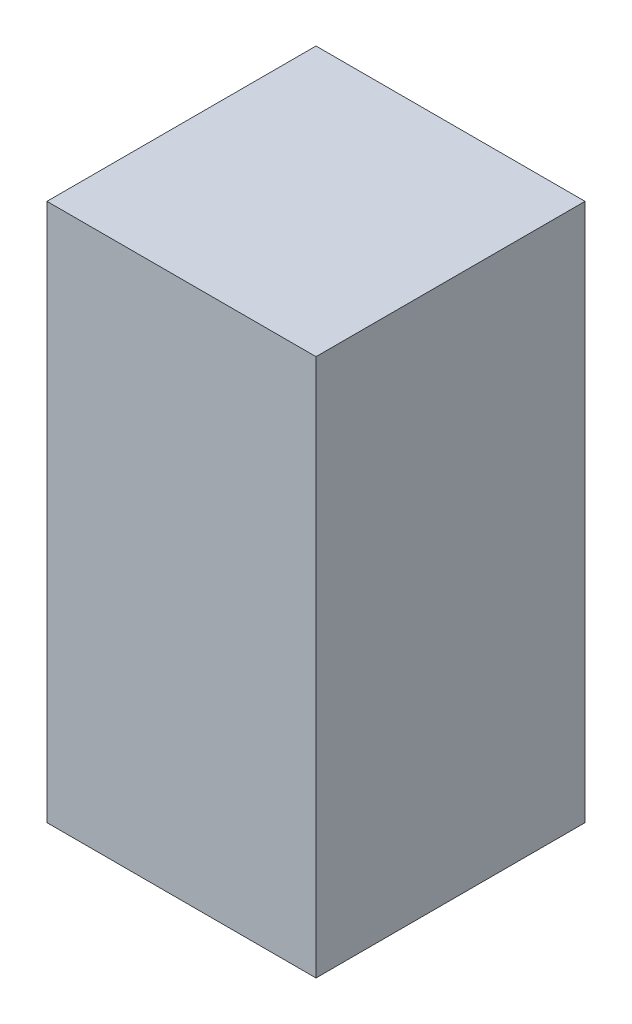
from build123d import *

# Parameters (mm, degrees)
PACK_LINEER_RULMAN_2_1_START = -385
SKETCH1_W                    = 30
SKETCH1_H                    = 60
PACK_LINEER_RULMAN_2_1_DEPTH = 30


with BuildPart() as part:
    # Sketch1 → PACK_lineer_rulman_2_1 (new body)
    with BuildSketch(Plane.XY.offset(PACK_LINEER_RULMAN_2_1_START)):
        with Locations((550, 500)):
            Rectangle(SKETCH1_W, SKETCH1_H)
    extrude(amount=-PACK_LINEER_RULMAN_2_1_DEPTH)


solid = part.part
